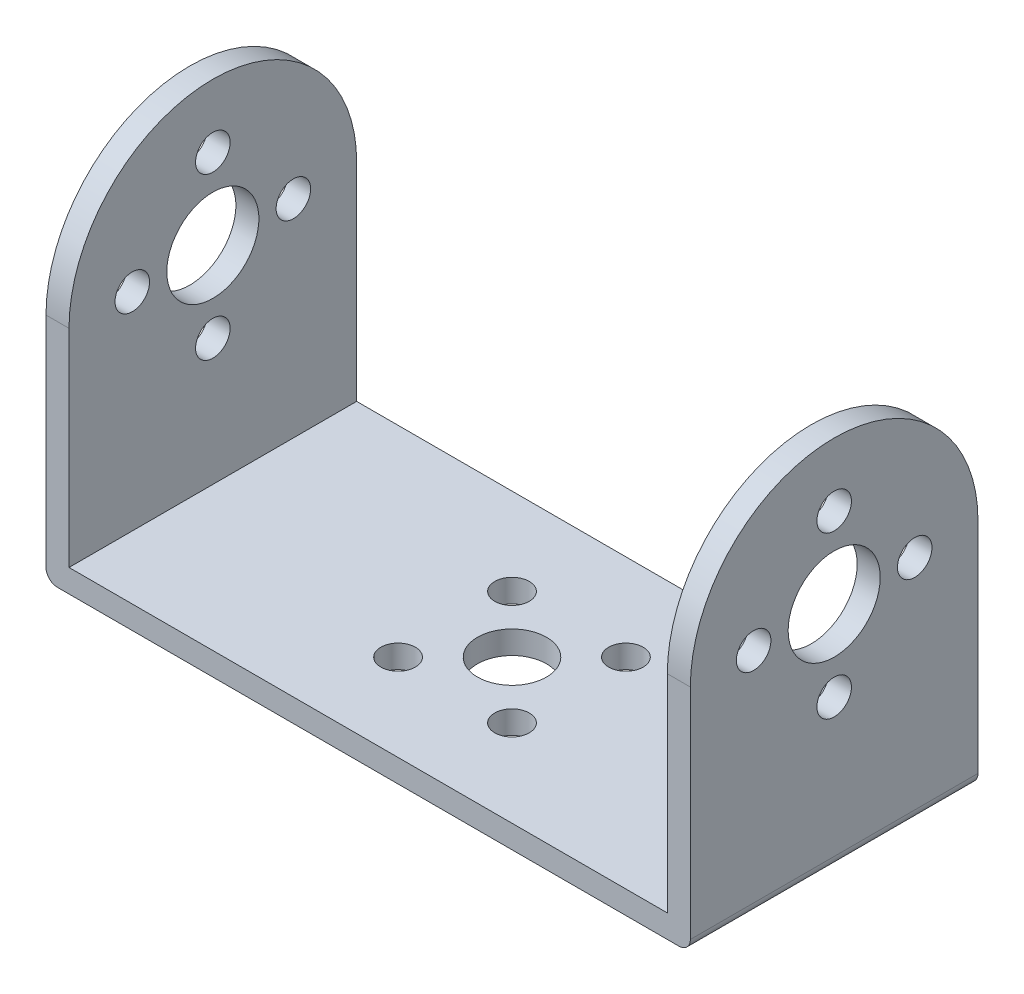
from build123d import *

# Parameters (mm, degrees)
SKETCH_1_W          = 56
SKETCH_1_H          = 25
EXTRUDE_1_DEPTH     = 2
SKETCH_2_R          = 3
SKETCH_2_R_2        = 1.5
CUT_EXTRUDE_1_DEPTH = 39.082744359
EXTRUDE_2_DEPTH     = 2
CUT_EXTRUDE_2_REACH = 68.086
SKETCH_4_R          = 4
SKETCH_4_R_2        = 1.5
FILLET_1_R          = 1


with BuildPart() as part:
    # 草图1 → 凸台-拉伸1 (new body)
    with BuildSketch(Plane(origin=(0, 0, 0), x_dir=(1, 0, 0), z_dir=(0, 1, 0))):
        with Locations((7.654255319, 0.731382979)):
            Rectangle(SKETCH_1_W, SKETCH_1_H)
    extrude(amount=EXTRUDE_1_DEPTH)

    # 草图2 → 切除-拉伸1 (cut, through all)
    with BuildSketch(Plane(origin=(0, 2, 0), x_dir=(1, 0, 0), z_dir=(0, 1, 0))):
        with Locations(Location((7.654255319, 0.731382979, 0), (0, 0, 270))):
            Circle(SKETCH_2_R)
        with Locations(Location((12.604002787, 5.681130447, 0), (0, 0, 270))):
            Circle(SKETCH_2_R_2)
        with Locations(Location((2.704507851, 5.681130447, 0), (0, 0, 270))):
            Circle(SKETCH_2_R_2)
        with Locations(Location((12.604002787, -4.21836449, 0), (0, 0, 270))):
            Circle(SKETCH_2_R_2)
        with Locations(Location((2.704507851, -4.21836449, 0), (0, 0, 270))):
            Circle(SKETCH_2_R_2)
    extrude(amount=-CUT_EXTRUDE_1_DEPTH, mode=Mode.SUBTRACT)

    # 草图3 → 凸台-拉伸2 (add)
    with BuildSketch(Plane.ZY.offset(20.345744681)):
        with BuildLine():
            Line((-13.231382979, 20), (-13.231382979, 2))
            Line((-13.231382979, 2), (11.768617021, 2))
            Line((11.768617021, 2), (11.768617021, 20))
            ThreePointArc((11.768617021, 20), (-0.731382979, 32.5), (-13.231382979, 20))
        make_face()
    extrude_2 = extrude(amount=-EXTRUDE_2_DEPTH)

    # 草图4 → 切除-拉伸2 (cut, up to next)
    with BuildSketch(Plane.ZY.offset(20.345744681), mode=Mode.PRIVATE) as cut_extrude_2_sk1:
        with Locations((-0.731382979, 20)):
            Circle(SKETCH_4_R)
    cut_extrude_2_tool1 = extrude(cut_extrude_2_sk1.sketch, amount=-CUT_EXTRUDE_2_REACH, mode=Mode.PRIVATE) & part.part
    # 草图4 → 切除-拉伸2 (cut, up to next)
    with BuildSketch(Plane.ZY.offset(20.345744681), mode=Mode.PRIVATE) as cut_extrude_2_sk2:
        with Locations((-0.731382979, 27)):
            Circle(SKETCH_4_R_2)
    cut_extrude_2_tool2 = extrude(cut_extrude_2_sk2.sketch, amount=-CUT_EXTRUDE_2_REACH, mode=Mode.PRIVATE) & part.part
    # 草图4 → 切除-拉伸2 (cut, up to next)
    with BuildSketch(Plane.ZY.offset(20.345744681), mode=Mode.PRIVATE) as cut_extrude_2_sk3:
        with Locations((6.268617021, 20)):
            Circle(SKETCH_4_R_2)
    cut_extrude_2_tool3 = extrude(cut_extrude_2_sk3.sketch, amount=-CUT_EXTRUDE_2_REACH, mode=Mode.PRIVATE) & part.part
    # 草图4 → 切除-拉伸2 (cut, up to next)
    with BuildSketch(Plane.ZY.offset(20.345744681), mode=Mode.PRIVATE) as cut_extrude_2_sk4:
        with Locations((-0.731382979, 13)):
            Circle(SKETCH_4_R_2)
    cut_extrude_2_tool4 = extrude(cut_extrude_2_sk4.sketch, amount=-CUT_EXTRUDE_2_REACH, mode=Mode.PRIVATE) & part.part
    # 草图4 → 切除-拉伸2 (cut, up to next)
    with BuildSketch(Plane.ZY.offset(20.345744681), mode=Mode.PRIVATE) as cut_extrude_2_sk5:
        with Locations((-7.731382979, 20)):
            Circle(SKETCH_4_R_2)
    cut_extrude_2_tool5 = extrude(cut_extrude_2_sk5.sketch, amount=-CUT_EXTRUDE_2_REACH, mode=Mode.PRIVATE) & part.part
    cut_extrude_2_1 = cut_extrude_2_tool1.solids().sort_by_distance((-20.345745, 20, -0.731383))[0]
    add(cut_extrude_2_1, mode=Mode.SUBTRACT)
    cut_extrude_2_2 = cut_extrude_2_tool2.solids().sort_by_distance((-20.345745, 27, -0.731383))[0]
    add(cut_extrude_2_2, mode=Mode.SUBTRACT)
    cut_extrude_2_3 = cut_extrude_2_tool3.solids().sort_by_distance((-20.345745, 20, 6.268617))[0]
    add(cut_extrude_2_3, mode=Mode.SUBTRACT)
    cut_extrude_2_4 = cut_extrude_2_tool4.solids().sort_by_distance((-20.345745, 13, -0.731383))[0]
    add(cut_extrude_2_4, mode=Mode.SUBTRACT)
    cut_extrude_2_5 = cut_extrude_2_tool5.solids().sort_by_distance((-20.345745, 20, -7.731383))[0]
    add(cut_extrude_2_5, mode=Mode.SUBTRACT)
    cut_extrude_2 = cut_extrude_2_1 + cut_extrude_2_2 + cut_extrude_2_3 + cut_extrude_2_4 + cut_extrude_2_5  # 切除-拉伸2 as one shape, for the pattern or mirror that repeats it

    # 镜向1: 凸台-拉伸2, 切除-拉伸2 across plane
    add(extrude_2.mirror(Plane.ZY.offset(-7.654255319)))
    add(cut_extrude_2.mirror(Plane.ZY.offset(-7.654255319)), mode=Mode.SUBTRACT)

    # 圆角1
    fillet_1_edges = [part.edges().sort_by_distance(p)[0] for p in [
        (35.654255319, 0, -0.731382979),
        (-20.345744681, 0, -0.731382979),
    ]]
    fillet(fillet_1_edges, radius=FILLET_1_R)


solid = part.part
